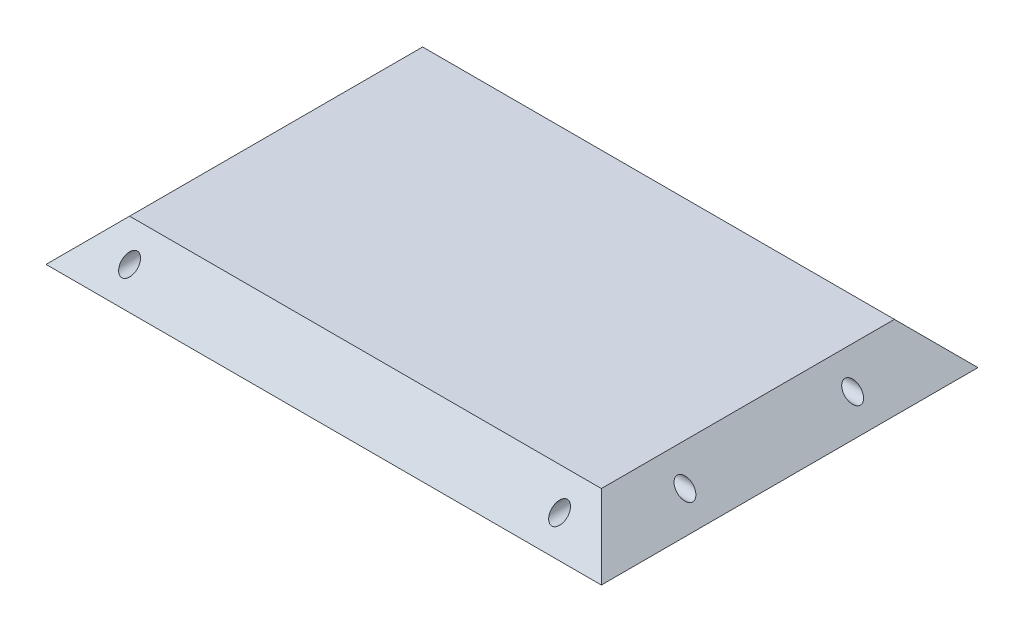
from build123d import *

# Parameters (mm, degrees)
SKETCH_3_R          = 1.85
CUT_EXTRUDE_1_DEPTH = 20
SKETCH_4_R          = 1.85
CUT_EXTRUDE_2_DEPTH = 20


with BuildPart() as part:
    # Эскиз1 → По сечениям1 section 0
    with BuildSketch(Plane(origin=(0, 0, 0), x_dir=(1, 0, 0), z_dir=(0, 1, 0))):
        with BuildLine():
            Line((-66.449008168, -45.061574365), (66.449008168, -45.061574365))
            Line((66.449008168, -45.061574365), (66.449008168, 45.061574365))
            Line((66.449008168, 45.061574365), (-66.449008168, 45.061574365))
            Line((-66.449008168, 45.061574365), (-66.449008168, -45.061574365))
        make_face()
    # Эскиз2 → По сечениям1 section 1
    with BuildSketch(Plane(origin=(0, 10, 0), x_dir=(1, 0, 0), z_dir=(0, 1, 0))):
        with BuildLine():
            Line((56.449008168, 35.061574365), (-56.449008168, 35.061574365))
            Line((-56.449008168, 35.061574365), (-56.449008168, -35.061574365))
            Line((-56.449008168, -35.061574365), (56.449008168, -35.061574365))
            Line((56.449008168, -35.061574365), (56.449008168, 35.061574365))
        make_face()
    loft()

    # Эскиз3 → Вырез-Вытянуть1 (cut)
    with BuildSketch(Plane.XY.offset(45.061574365)):
        with Locations((51.449008168, 5)):
            Circle(SKETCH_3_R)
        with Locations(Location((-51.449008168, 5, 0), (0, 0, 270))):
            Circle(SKETCH_3_R)
    cut_extrude_1 = extrude(amount=-CUT_EXTRUDE_1_DEPTH, mode=Mode.SUBTRACT)

    # Зеркальное отражение1: Вырез-Вытянуть1 across plane
    add(cut_extrude_1.mirror(Plane.XY), mode=Mode.SUBTRACT)

    # Эскиз4 → Вырез-Вытянуть2 (cut)
    with BuildSketch(Plane(origin=(66.449008168, 0, 0), x_dir=(0, 0, -1), z_dir=(1, 0, 0))):
        with Locations((-20.061574365, 5)):
            Circle(SKETCH_4_R)
        with Locations(Location((20.061574365, 5, 0), (0, 0, 270))):
            Circle(SKETCH_4_R)
    cut_extrude_2 = extrude(amount=-CUT_EXTRUDE_2_DEPTH, mode=Mode.SUBTRACT)

    # Зеркальное отражение2: Вырез-Вытянуть2 across plane
    add(cut_extrude_2.mirror(Plane(origin=(0, 0, 0), x_dir=(0, 0, 1), z_dir=(1, 0, 0))), mode=Mode.SUBTRACT)


solid = part.part
